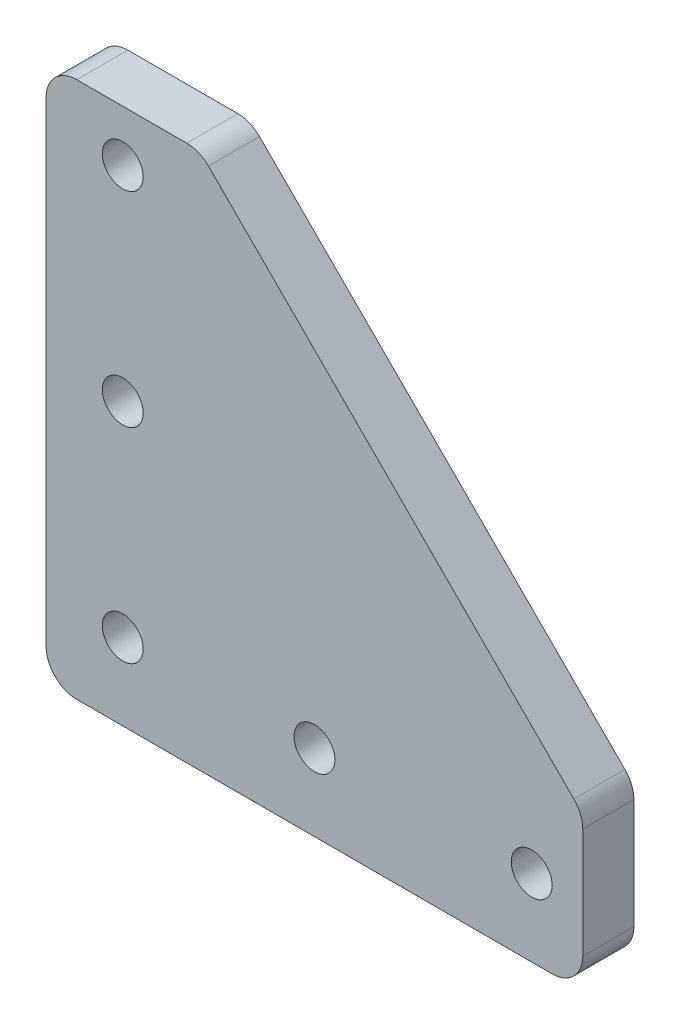
from build123d import *

# Parameters (mm, degrees)
SKETCH_1_R      = 2
EXTRUDE_1_DEPTH = 5
FILLET_1_R      = 3


with BuildPart() as part:
    # ｽｹｯﾁ1 → ﾎﾞｽ - 押し出し1 (new body)
    with BuildSketch(Plane.XY):
        Polygon((52.5, 15), (15, 52.5), (0, 52.5), (0, 0), (52.5, 0), align=None)
        with Locations((7.5, 7.5)):
            Circle(SKETCH_1_R, mode=Mode.SUBTRACT)
        with Locations((26.25, 7.5)):
            Circle(SKETCH_1_R, mode=Mode.SUBTRACT)
        with Locations((47.5, 7.5)):
            Circle(SKETCH_1_R, mode=Mode.SUBTRACT)
        with Locations((7.5, 27.5)):
            Circle(SKETCH_1_R, mode=Mode.SUBTRACT)
        with Locations((7.5, 47.5)):
            Circle(SKETCH_1_R, mode=Mode.SUBTRACT)
    extrude(amount=EXTRUDE_1_DEPTH)

    # ﾌｨﾚｯﾄ1
    fillet_1_edges = [part.edges().sort_by_distance(p)[0] for p in [
        (0, 0, 2.5),
        (0, 52.5, 2.5),
        (15, 52.5, 2.5),
        (52.5, 15, 2.5),
        (52.5, 0, 2.5),
    ]]
    fillet(fillet_1_edges, radius=FILLET_1_R)


solid = part.part
